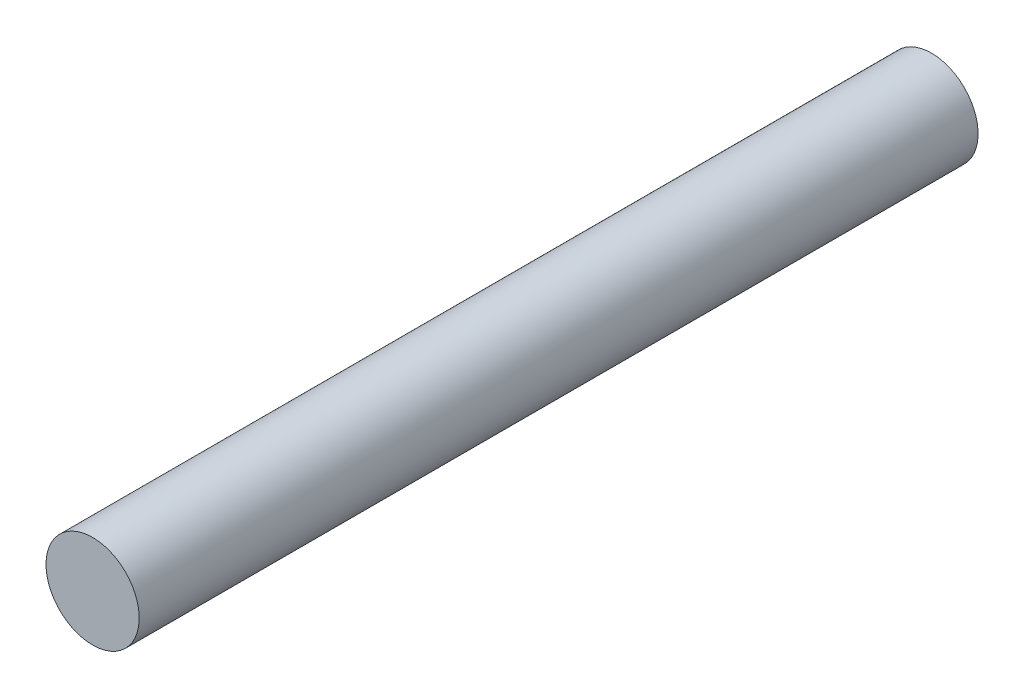
from build123d import *

# Parameters (mm, degrees)
SKETCH1_R           = 10
BOSS_EXTRUDE1_DEPTH = 180


with BuildPart() as part:
    # Sketch1 → Boss-Extrude1 (new body)
    with BuildSketch(Plane.XY):
        with Locations(Location((0, 0, 0), (0, 0, 180))):
            Circle(SKETCH1_R)
    extrude(amount=BOSS_EXTRUDE1_DEPTH)


solid = part.part
